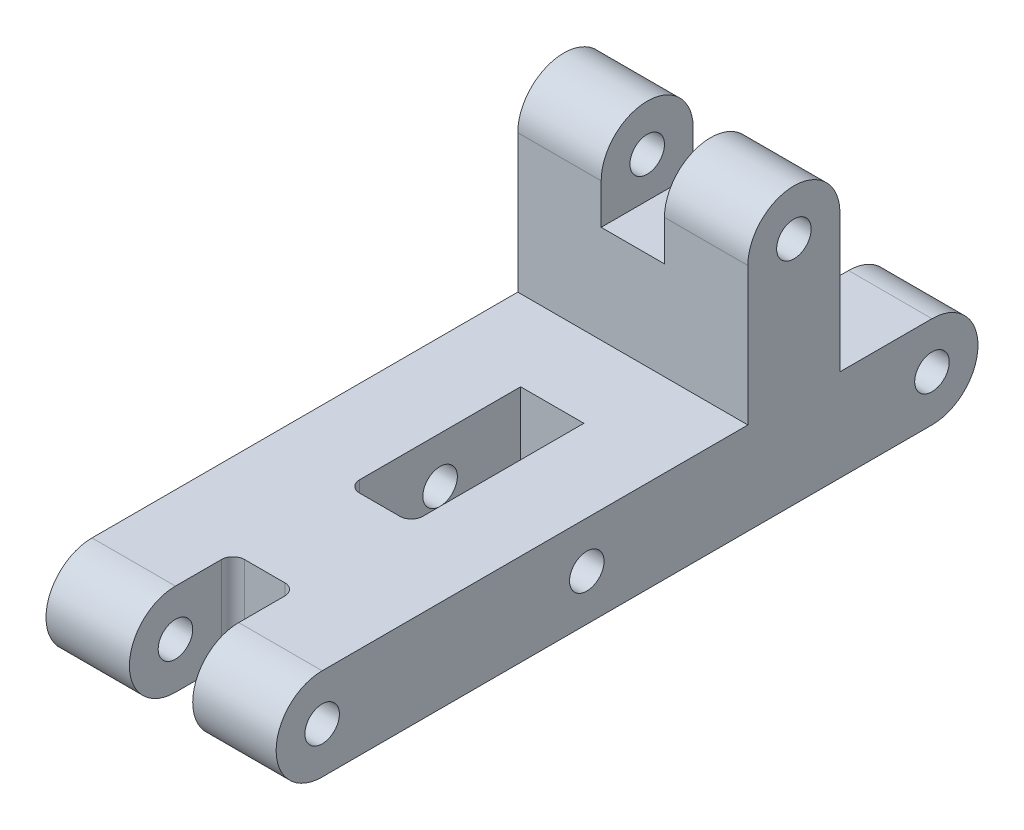
from build123d import *

# Parameters (mm, degrees)
CROQUIS1_R              = 1.5
SALIENTE_EXTRUIR1_DEPTH = 10
CROQUIS2_W              = 8
CROQUIS2_H              = 7.5
CROQUIS2_W_2            = 15
CROQUIS2_H_2            = 8
CROQUIS2_W_3            = 9
CORTAR_EXTRUIR1_DEPTH   = 2.75
REDONDEO1_R             = 1


with BuildPart() as part:
    # Croquis1 → Saliente-Extruir1 (new, symmetric)
    with BuildSketch(Plane(origin=(0, 0, 0), x_dir=(0, 0, -1), z_dir=(1, 0, 0))):
        with BuildLine():
            Line((-15, 4), (-1, 4))
            Line((-1, 4), (-1, 16))
            ThreePointArc((-1, 16), (3, 20), (7, 16))
            Line((7, 16), (7, 4))
            Line((7, 4), (15, 4))
            ThreePointArc((15, 4), (19, 0), (15, -4))
            Line((15, -4), (-15, -4))
            Line((-15, -4), (-38, -4))
            ThreePointArc((-38, -4), (-42, 0), (-38, 4))
            Line((-38, 4), (-15, 4))
        make_face()
        with Locations((15, 0)):
            Circle(CROQUIS1_R, mode=Mode.SUBTRACT)
        with Locations((3, 16)):
            Circle(CROQUIS1_R, mode=Mode.SUBTRACT)
        with Locations((-15, 0)):
            Circle(CROQUIS1_R, mode=Mode.SUBTRACT)
        with Locations((-38, 0)):
            Circle(CROQUIS1_R, mode=Mode.SUBTRACT)
    extrude(amount=SALIENTE_EXTRUIR1_DEPTH, both=True)

    # Croquis2 → Cortar-Extruir1 (cut, symmetric)
    with BuildSketch(Plane(origin=(0, 0, 0), x_dir=(0, 0, -1), z_dir=(1, 0, 0))):
        with Locations((3, 16.25)):
            Rectangle(CROQUIS2_W, CROQUIS2_H)
        with Locations((-15.5, 0)):
            Rectangle(CROQUIS2_W_2, CROQUIS2_H_2)
        with Locations((14.5, 0)):
            Rectangle(CROQUIS2_W_3, CROQUIS2_H_2)
        with Locations((-37.5, 0)):
            Rectangle(CROQUIS2_W_3, CROQUIS2_H_2)
    extrude(amount=CORTAR_EXTRUIR1_DEPTH, both=True, mode=Mode.SUBTRACT)

    # Redondeo1
    redondeo1_edges = [part.edges().sort_by_distance(p)[0] for p in [
        (2.75, 0, -10),
        (-2.75, 0, -10),
        (-2.75, 0, 23),
        (2.75, 0, 23),
        (2.75, 0, 33),
        (-2.75, 0, 33),
    ]]
    fillet(redondeo1_edges, radius=REDONDEO1_R)


solid = part.part
